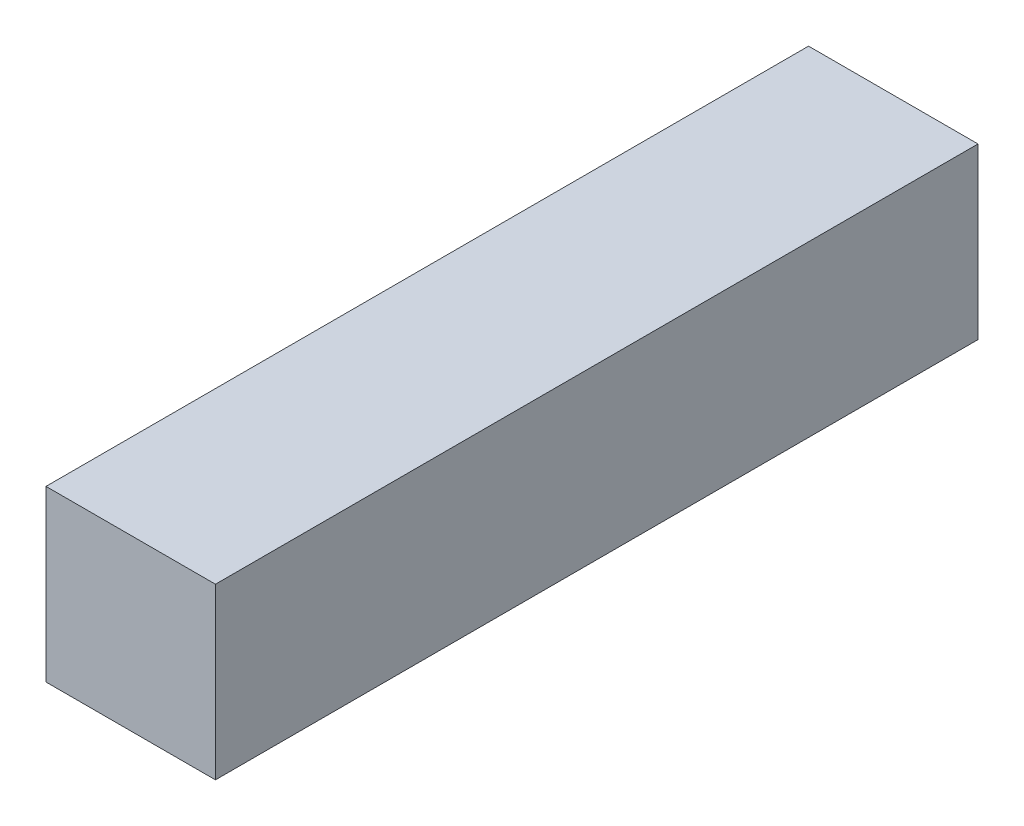
from build123d import *

# Parameters (mm, degrees)
SKETCH1_W           = 3.175
SKETCH1_H           = 3.175
BOSS_EXTRUDE1_DEPTH = 7.14375


with BuildPart() as part:
    # Sketch1 → Boss-Extrude1 (new, symmetric)
    with BuildSketch(Plane.XY):
        Rectangle(SKETCH1_W, SKETCH1_H)
    extrude(amount=BOSS_EXTRUDE1_DEPTH, both=True)


solid = part.part
